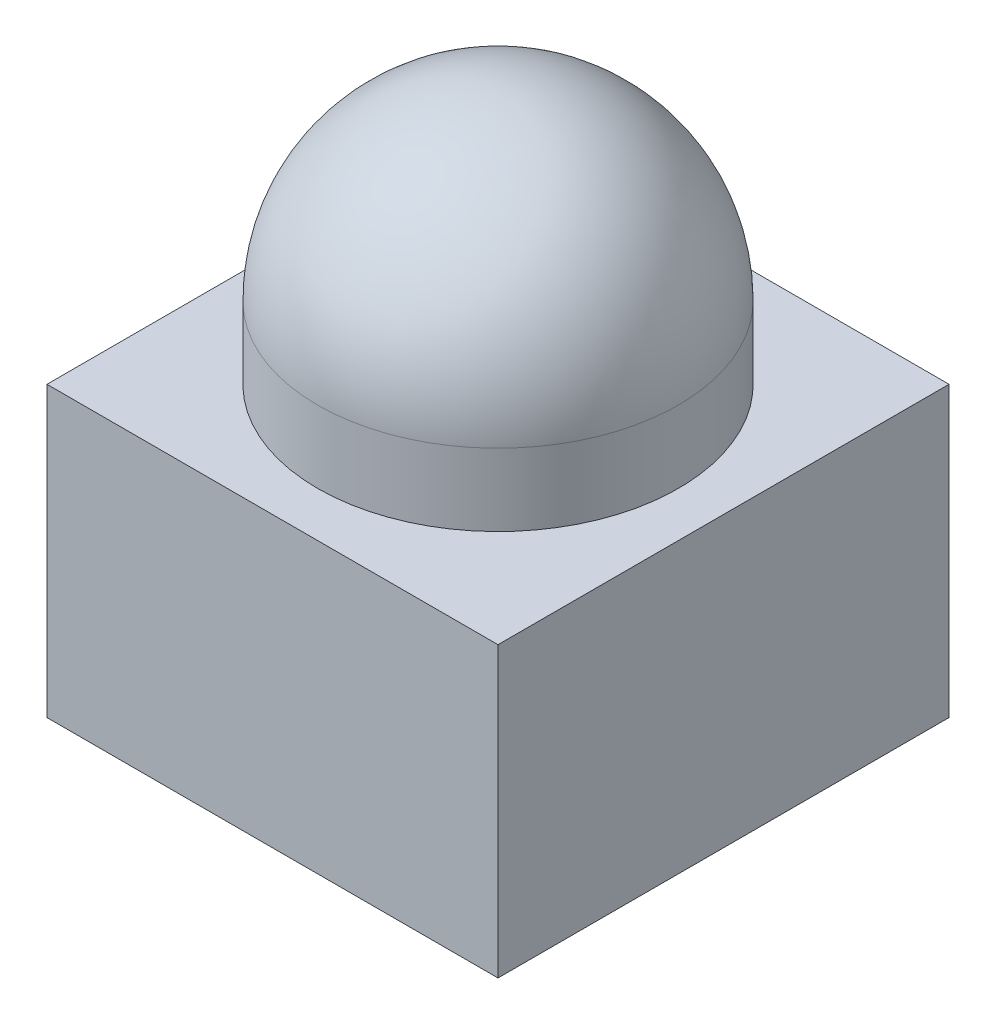
from build123d import *

# Parameters (mm, degrees)
SKETCH1_W           = 2.5
SKETCH1_H           = 2.5
BOSS_EXTRUDE1_DEPTH = 1.6
SKETCH2_R           = 1
BOSS_EXTRUDE2_DEPTH = 1.4
FILLET1_R           = 1


with BuildPart() as part:
    # Sketch1 → Boss-Extrude1 (new body)
    with BuildSketch(Plane(origin=(0, 0, 0), x_dir=(1, 0, 0), z_dir=(0, 1, 0))):
        with Locations((1.25, 1.25)):
            Rectangle(SKETCH1_W, SKETCH1_H)
    extrude(amount=BOSS_EXTRUDE1_DEPTH)

    # Sketch2 → Boss-Extrude2 (add)
    with BuildSketch(Plane(origin=(0, 1.6, 0), x_dir=(1, 0, 0), z_dir=(0, 1, 0))):
        with Locations(Location((1.25, 1.25, 0), (0, 0, 270))):
            Circle(SKETCH2_R)
    extrude(amount=BOSS_EXTRUDE2_DEPTH)

    # Fillet1
    fillet1_edges = [part.edges().sort_by_distance(p)[0] for p in [
        (1.25, 3, -2.25),
    ]]
    fillet(fillet1_edges, radius=FILLET1_R)


solid = part.part
